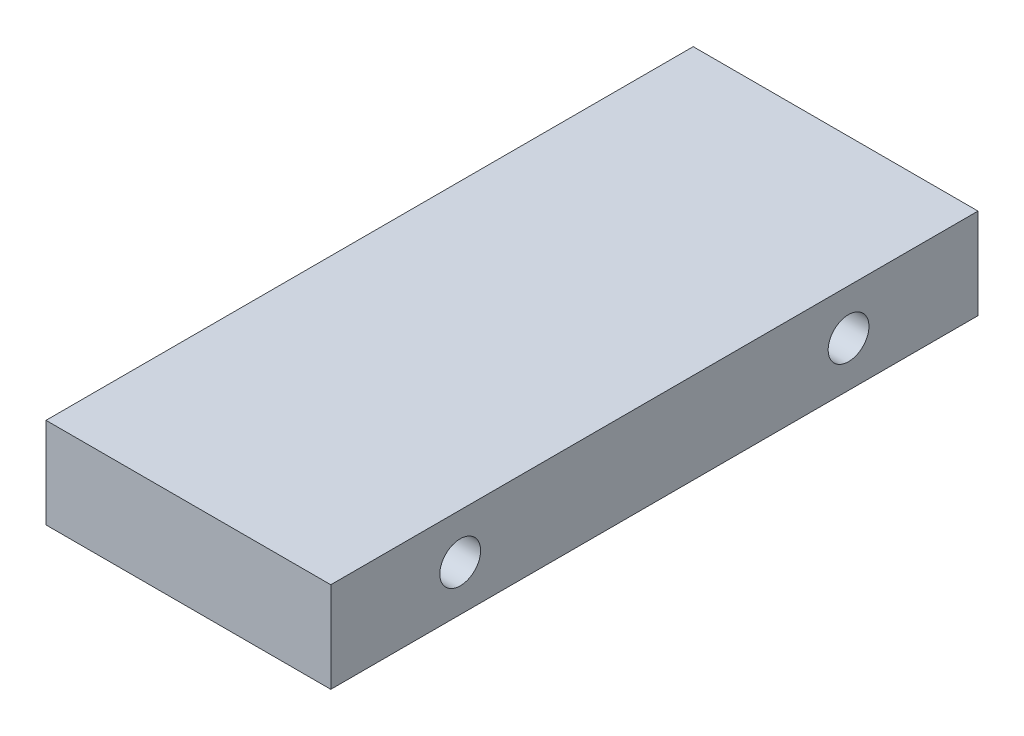
from build123d import *

# Parameters (mm, degrees)
SKETCH_1_W            = 50
SKETCH_1_H            = 7
EXTRUDE_1_DEPTH       = 22
HOLE_WIZARD_M31_D     = 3.15
HOLE_WIZARD_M31_DEPTH = 10
HOLE_WIZARD_M31_TIP   = 0.946355475
HOLE_WIZARD_M32_D     = 3.15
HOLE_WIZARD_M32_DEPTH = 10
HOLE_WIZARD_M32_TIP   = 0.946355475


with BuildPart() as part:
    # Эскиз1 → Бобышка-Вытянуть1 (new body)
    with BuildSketch(Plane(origin=(0, 0, 0), x_dir=(0, 0, -1), z_dir=(1, 0, 0))):
        with Locations((-20.27623422, 0.143640104)):
            Rectangle(SKETCH_1_W, SKETCH_1_H)
    extrude(amount=EXTRUDE_1_DEPTH)

    # Сверло под метчик  спиральное M31
    with Locations(Plane(origin=(22, 0, 0), x_dir=(0, 0, -1), z_dir=(1, 0, 0))):
        with Locations((-35.27623422, 0.143640104), (-5.27623422, 0.143640104)):
            Hole(HOLE_WIZARD_M31_D / 2, depth=HOLE_WIZARD_M31_DEPTH)
            with Locations((0, 0, -(HOLE_WIZARD_M31_DEPTH + HOLE_WIZARD_M31_TIP / 2))):  # 118° drill point
                Cone(0, HOLE_WIZARD_M31_D / 2, HOLE_WIZARD_M31_TIP, mode=Mode.SUBTRACT)

    # Сверло под метчик  спиральное M32
    with Locations(Plane.ZY):
        with Locations((20.27623422, 0.143640104)):
            Hole(HOLE_WIZARD_M32_D / 2, depth=HOLE_WIZARD_M32_DEPTH)
            with Locations((0, 0, -(HOLE_WIZARD_M32_DEPTH + HOLE_WIZARD_M32_TIP / 2))):  # 118° drill point
                Cone(0, HOLE_WIZARD_M32_D / 2, HOLE_WIZARD_M32_TIP, mode=Mode.SUBTRACT)


solid = part.part
